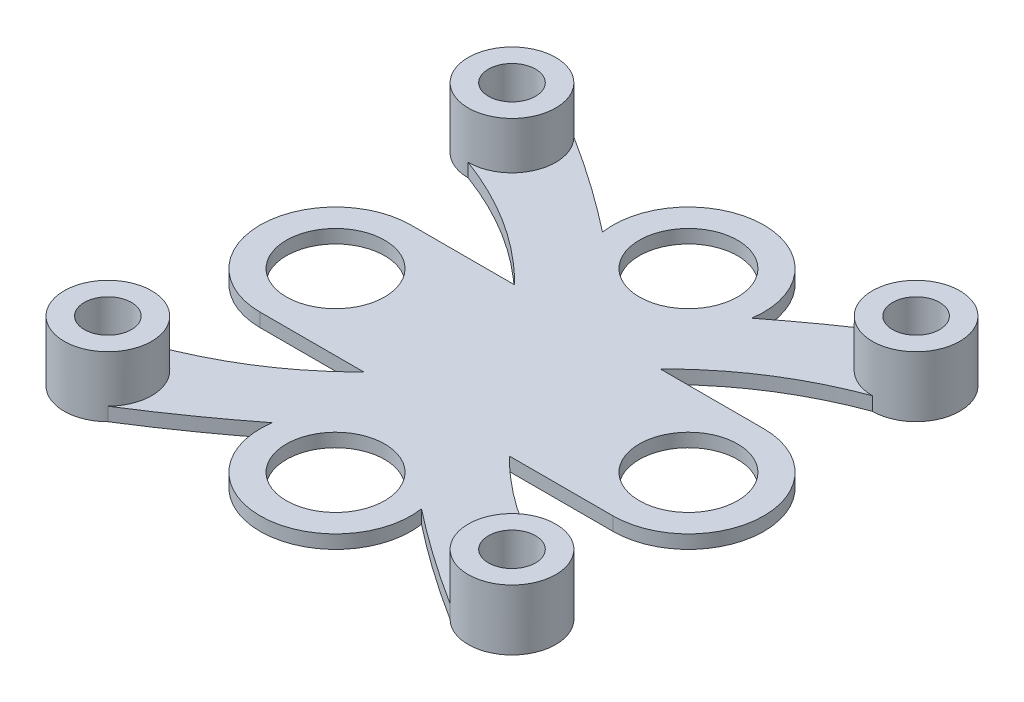
from build123d import *

# Parameters (mm, degrees)
SKETCH1_R           = 3.65
SKETCH1_R_2         = 1.75
BOSS_EXTRUDE1_DEPTH = 1
SKETCH2_R           = 3.25
SKETCH2_R_2         = 1.75
BOSS_EXTRUDE2_DEPTH = 3.5


with BuildPart() as part:
    # Sketch1 → Boss-Extrude1 (new body)
    with BuildSketch(Plane(origin=(0, 0, 0), x_dir=(1, 0, 0), z_dir=(0, 1, 0))):
        with BuildLine():
            Line((5.410568808, -5.6), (13.1, -5.6))
            ThreePointArc((13.1, -5.6), (18.7, 0), (13.1, 5.6))
            Line((13.1, 5.6), (5.410568808, 5.6))
            add(Edge.make_bspline(
                [(15, 11.75), (9.437012866, 9.684618997), (5.410568808, 5.6)],
                knots=[0, 0, 0, 0.823024689, 0.823024689, 0.823024689], degree=2))
            ThreePointArc((15, 11.75), (18.002608481, 16.243721155), (12.701902961, 17.298097039))
            add(Edge.make_bspline(
                [(12.701902961, 17.298097039), (8.967561343, 14.947817201), (5.535660126, 12.253556278)],
                knots=[0, 0, 0, 0.409026758, 0.409026758, 0.409026758], degree=2))
            ThreePointArc((5.535660126, 12.253556278), (0, 18.7), (-5.535660126, 12.253556278))
            add(Edge.make_bspline(
                [(-5.535660126, 12.253556278), (-8.967561343, 14.947817201), (-12.701902961, 17.298097039)],
                knots=[0.751545437, 0.751545437, 0.751545437, 1.160572194, 1.160572194, 1.160572194], degree=2))
            ThreePointArc((-12.701902961, 17.298097039), (-18.002608481, 16.243721155), (-15, 11.75))
            add(Edge.make_bspline(
                [(-15, 11.75), (-9.437012866, 9.684618997), (-5.410568808, 5.6)],
                knots=[0, 0, 0, 0.823024689, 0.823024689, 0.823024689], degree=2))
            Line((-5.410568808, 5.6), (-13.1, 5.6))
            ThreePointArc((-13.1, 5.6), (-18.7, 0), (-13.1, -5.6))
            Line((-13.1, -5.6), (-5.410568808, -5.6))
            add(Edge.make_bspline(
                [(-15, -11.75), (-9.437012866, -9.684618997), (-5.410568808, -5.6)],
                knots=[0, 0, 0, 0.823024689, 0.823024689, 0.823024689], degree=2))
            ThreePointArc((-15, -11.75), (-18.002608481, -16.243721155), (-12.701902961, -17.298097039))
            add(Edge.make_bspline(
                [(-12.701902961, -17.298097039), (-8.967561343, -14.947817201), (-5.535660126, -12.253556278)],
                knots=[0, 0, 0, 0.409026758, 0.409026758, 0.409026758], degree=2))
            ThreePointArc((-5.535660126, -12.253556278), (0, -18.7), (5.535660126, -12.253556278))
            add(Edge.make_bspline(
                [(5.535660126, -12.253556278), (8.967561343, -14.947817201), (12.701902961, -17.298097039)],
                knots=[0.751545437, 0.751545437, 0.751545437, 1.160572194, 1.160572194, 1.160572194], degree=2))
            ThreePointArc((12.701902961, -17.298097039), (18.002608481, -16.243721155), (15, -11.75))
            add(Edge.make_bspline(
                [(15, -11.75), (9.437012866, -9.684618997), (5.410568808, -5.6)],
                knots=[0, 0, 0, 0.823024689, 0.823024689, 0.823024689], degree=2))
        make_face()
        with Locations(Location((0, 13.1, 0), (0, 0, 270))):
            Circle(SKETCH1_R, mode=Mode.SUBTRACT)
        with Locations(Location((0, -13.1, 0), (0, 0, 270))):
            Circle(SKETCH1_R, mode=Mode.SUBTRACT)
        with Locations(Location((13.1, 0, 0), (0, 0, 270))):
            Circle(SKETCH1_R, mode=Mode.SUBTRACT)
        with Locations(Location((15, 15, 0), (0, 0, 270))):
            Circle(SKETCH1_R_2, mode=Mode.SUBTRACT)
        with Locations(Location((-13.1, 0, 0), (0, 0, 270))):
            Circle(SKETCH1_R, mode=Mode.SUBTRACT)
        with Locations(Location((-15, 15, 0), (0, 0, 270))):
            Circle(SKETCH1_R_2, mode=Mode.SUBTRACT)
        with Locations(Location((15, -15, 0), (0, 0, 270))):
            Circle(SKETCH1_R_2, mode=Mode.SUBTRACT)
        with Locations(Location((-15, -15, 0), (0, 0, 270))):
            Circle(SKETCH1_R_2, mode=Mode.SUBTRACT)
    extrude(amount=BOSS_EXTRUDE1_DEPTH)

    # Sketch2 → Boss-Extrude2 (add)
    # profile 1 of 4: a face of its own
    with BuildSketch(Plane(origin=(0, 1, 0), x_dir=(1, 0, 0), z_dir=(0, 1, 0))):
        with Locations(Location((-15, 15, 0), (0, 0, 270))):
            Circle(SKETCH2_R)
        with Locations(Location((-15, 15, 0), (0, 0, 270))):
            Circle(SKETCH2_R_2, mode=Mode.SUBTRACT)
    # profile 2 of 4: a face of its own
    with BuildSketch(Plane(origin=(0, 1, 0), x_dir=(1, 0, 0), z_dir=(0, 1, 0))):
        with Locations(Location((15, 15, 0), (0, 0, 270))):
            Circle(SKETCH2_R)
        with Locations(Location((15, 15, 0), (0, 0, 270))):
            Circle(SKETCH2_R_2, mode=Mode.SUBTRACT)
    # profile 3 of 4: a face of its own
    with BuildSketch(Plane(origin=(0, 1, 0), x_dir=(1, 0, 0), z_dir=(0, 1, 0))):
        with Locations(Location((15, -15, 0), (0, 0, 90))):
            Circle(SKETCH2_R)
        with Locations(Location((15, -15, 0), (0, 0, 270))):
            Circle(SKETCH2_R_2, mode=Mode.SUBTRACT)
    # profile 4 of 4: a face of its own
    with BuildSketch(Plane(origin=(0, 1, 0), x_dir=(1, 0, 0), z_dir=(0, 1, 0))):
        with Locations(Location((-15, -15, 0), (0, 0, 90))):
            Circle(SKETCH2_R)
        with Locations(Location((-15, -15, 0), (0, 0, 270))):
            Circle(SKETCH2_R_2, mode=Mode.SUBTRACT)
    extrude(amount=BOSS_EXTRUDE2_DEPTH)


solid = part.part
